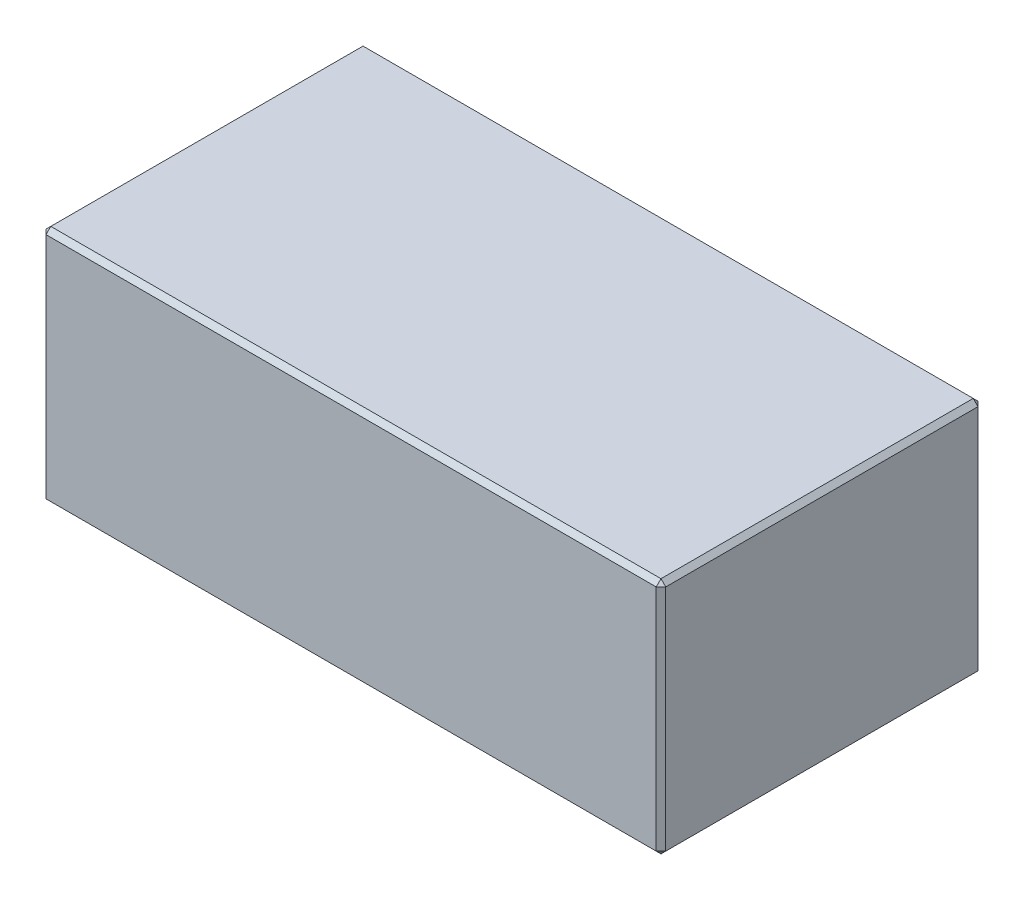
from build123d import *

# Parameters (mm, degrees)
SKETCH1_W           = 130
SKETCH1_H           = 67.5
BOSS_EXTRUDE1_DEPTH = 50
CHAMFER1_SIZE       = 1


with BuildPart() as part:
    # Sketch1 → Boss-Extrude1 (new body)
    with BuildSketch(Plane(origin=(0, 0, 0), x_dir=(1, 0, 0), z_dir=(0, 1, 0))):
        Rectangle(SKETCH1_W, SKETCH1_H)
    extrude(amount=BOSS_EXTRUDE1_DEPTH)

    # Chamfer1
    chamfer1_edges = [part.edges().sort_by_distance(p)[0] for p in [
        (65, 50, 0),
        (0, 50, -33.75),
        (-65, 50, 0),
        (0, 0, -33.75),
        (65, 0, 0),
        (0, 0, 33.75),
        (-65, 0, 0),
        (-65, 25, -33.75),
        (65, 25, -33.75),
        (65, 25, 33.75),
        (-65, 25, 33.75),
        (0, 50, 33.75),
    ]]
    chamfer(chamfer1_edges, length=CHAMFER1_SIZE)


solid = part.part
